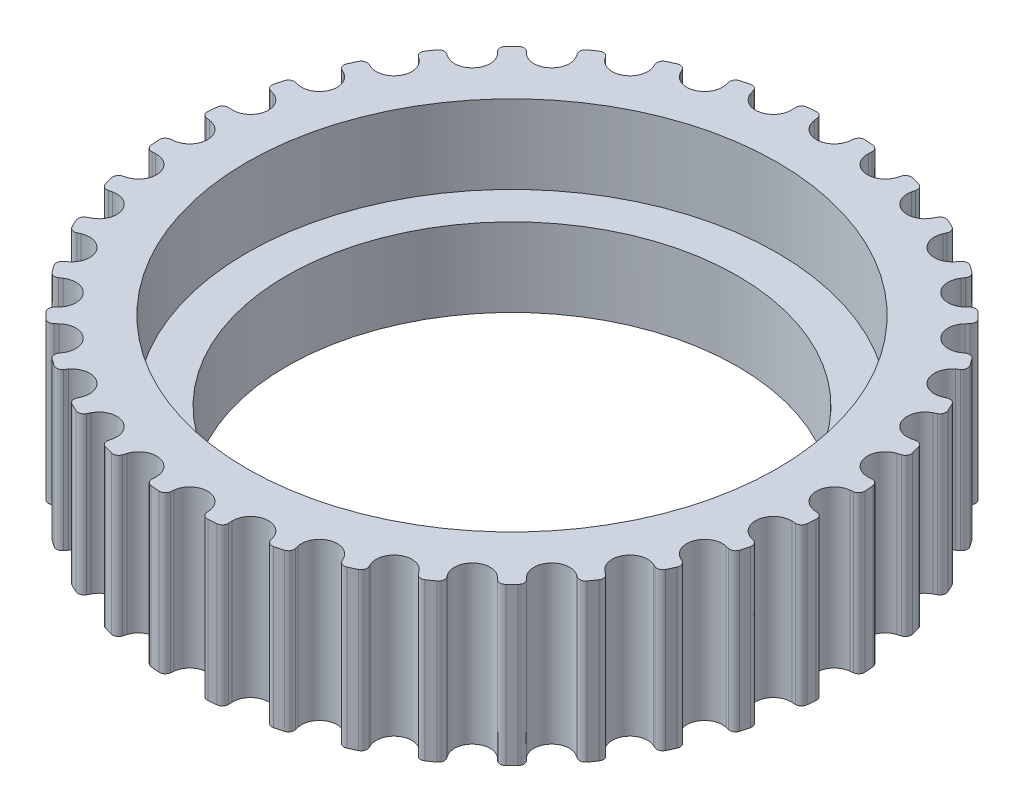
from build123d import *

# Parameters (mm, degrees)
SKETCH_1_R               = 16.8
EXTRUDE_1_DEPTH          = 4
CUT_EXTRUDE_1_DEPTH      = 50
PATTERN_CIRCULAR_1_COUNT = 36
SKETCH_4_R               = 13.525
CUT_EXTRUDE_2_DEPTH      = 4
SKETCH_13_R              = 11.5
CUT_EXTRUDE_10_DEPTH     = 19.5
SKETCH_14_R              = 1.25
CUT_EXTRUDE_11_DEPTH     = 3
SKETCH_15_R              = 14
CUT_EXTRUDE_12_DEPTH     = 1
SKETCH_16_R              = 14
SKETCH_16_R_2            = 11.5
EXTRUDE_3_DEPTH          = 1


with BuildPart() as part:
    # 草图1 → 凸台-拉伸1 (new, symmetric)
    with BuildSketch(Plane(origin=(0, 0, 0), x_dir=(1, 0, 0), z_dir=(0, 1, 0))):
        Circle(SKETCH_1_R)
    extrude(amount=EXTRUDE_1_DEPTH, both=True)

    # 草图2 → 切除-拉伸1 (cut, symmetric)
    with BuildSketch(Plane(origin=(0, 0, 0), x_dir=(1, 0, 0), z_dir=(0, 1, 0))):
        with BuildLine():
            Line((-0.903216998, 16.319098898), (-0.924353128, 16.491238864))
            ThreePointArc((-0.924353128, 16.491238864), (-1.031794245, 16.686577305), (-1.244337282, 16.753854026))
            ThreePointArc((-1.244337282, 16.753854026), (0, 16.8), (1.244337282, 16.753854026))
            ThreePointArc((1.244337282, 16.753854026), (1.031794245, 16.686577305), (0.924353128, 16.491238864))
            Line((0.924353128, 16.491238864), (0.903216998, 16.319098898))
            ThreePointArc((0.903216998, 16.319098898), (0, 15.52), (-0.903216998, 16.319098898))
        make_face()
    cut_extrude_1 = extrude(amount=CUT_EXTRUDE_1_DEPTH, both=True, mode=Mode.SUBTRACT)

    # 阵列(圆周)1: 切除-拉伸1 ×36 about axis
    pattern_circular_1_axis = Axis((0, -44, 0), (0, 1, 0))
    for i in range(1, PATTERN_CIRCULAR_1_COUNT):
        add(cut_extrude_1.rotate(pattern_circular_1_axis, i * 360 / PATTERN_CIRCULAR_1_COUNT), mode=Mode.SUBTRACT)

    # 草图4 → 切除-拉伸2 (cut)
    with BuildSketch(Plane(origin=(0, 4, 0), x_dir=(1, 0, 0), z_dir=(0, 1, 0))):
        Circle(SKETCH_4_R)
    extrude(amount=-CUT_EXTRUDE_2_DEPTH, mode=Mode.SUBTRACT)

    # 草图13 → 切除-拉伸10 (cut)
    with BuildSketch(Plane.XZ.offset(4)):
        Circle(SKETCH_13_R)
    extrude(amount=-CUT_EXTRUDE_10_DEPTH, mode=Mode.SUBTRACT)

    # 草图14 → 切除-拉伸11 (cut)
    with BuildSketch(Plane.XZ.offset(4)):
        with Locations((5.916655664, 12.688309019)):
            Circle(SKETCH_14_R)
        with Locations((13.946725773, 1.220180398)):
            Circle(SKETCH_14_R)
        with Locations((8.030070109, -11.46812862)):
            Circle(SKETCH_14_R)
        with Locations((-5.916655664, -12.688309019)):
            Circle(SKETCH_14_R)
        with Locations((-13.946725773, -1.220180398)):
            Circle(SKETCH_14_R)
        with Locations((-8.030070109, 11.46812862)):
            Circle(SKETCH_14_R)
    extrude(amount=-CUT_EXTRUDE_11_DEPTH, mode=Mode.SUBTRACT)

    # 草图15 → 切除-拉伸12 (cut)
    with BuildSketch(Plane(origin=(0, 0, 0), x_dir=(1, 0, 0), z_dir=(0, 1, 0))):
        Circle(SKETCH_15_R)
    extrude(amount=-CUT_EXTRUDE_12_DEPTH, mode=Mode.SUBTRACT)

    # 草图16 → 凸台-拉伸3 (add)
    with BuildSketch(Plane(origin=(0, -1, 0), x_dir=(1, 0, 0), z_dir=(0, 1, 0))):
        Circle(SKETCH_16_R)
        Circle(SKETCH_16_R_2, mode=Mode.SUBTRACT)
    extrude(amount=EXTRUDE_3_DEPTH)


solid = part.part
